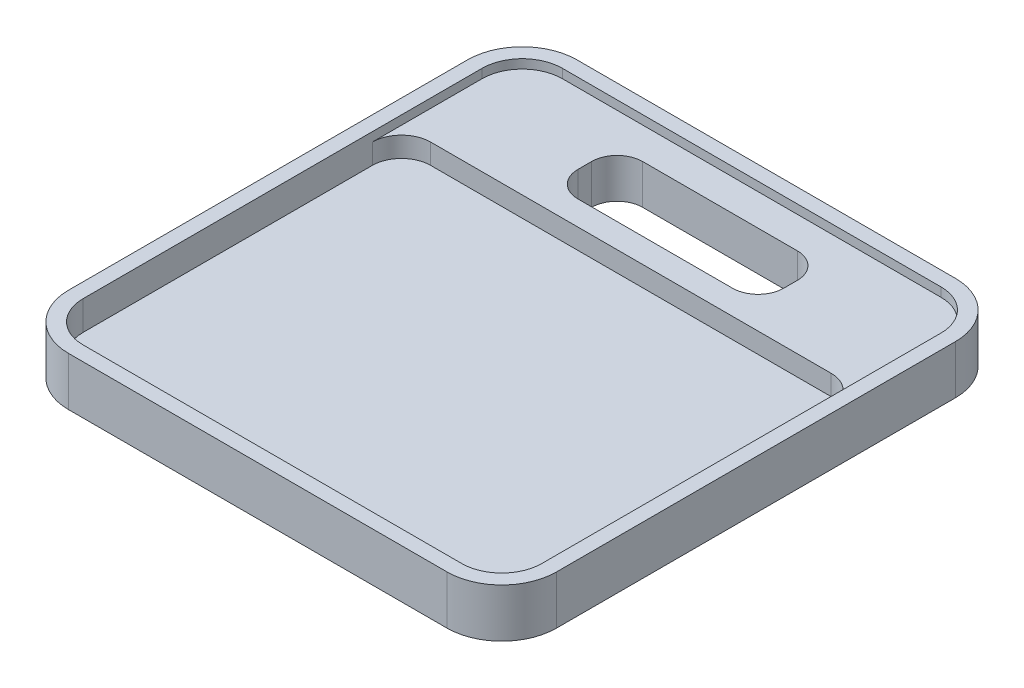
from build123d import *

# Parameters (mm, degrees)
EXTRUDE_1_DEPTH     = 2
CUT_EXTRUDE_1_DEPTH = 15.604642381
EXTRUDE_START       = -1.63
EXTRUDE_2_DEPTH     = 1.63
CUT_EXTRUDE_2_DEPTH = 1.2
CUT_EXTRUDE_3_DEPTH = 0.37
FILLET_3_R          = 1.2


with BuildPart() as part:
    # 草图1 → 凸台-拉伸1 (new body)
    with BuildSketch(Plane(origin=(0, 0, 0), x_dir=(-1, 0, 0), z_dir=(0, 1, 0))):
        with BuildLine():
            Line((7.77, 10.437594514), (-7.77, 10.437594514))
            ThreePointArc((-7.77, 10.437594514), (-9.359289322, 9.779289322), (-10.017594514, 8.19))
            Line((-10.017594514, 8.19), (-10.017594514, -8.19))
            ThreePointArc((-10.017594514, -8.19), (-9.359289322, -9.779289322), (-7.77, -10.437594514))
            Line((-7.77, -10.437594514), (7.77, -10.437594514))
            ThreePointArc((7.77, -10.437594514), (9.359289322, -9.779289322), (10.017594514, -8.19))
            Line((10.017594514, -8.19), (10.017594514, 8.19))
            ThreePointArc((10.017594514, 8.19), (9.359289322, 9.779289322), (7.77, 10.437594514))
        make_face()
    extrude(amount=EXTRUDE_1_DEPTH)

    # 草图3 → 切除-拉伸1 (cut, through all)
    with BuildSketch(Plane(origin=(0, 2, 0), x_dir=(1, 0, 0), z_dir=(0, 1, 0))):
        with BuildLine():
            Line((3.175, 8.940777212), (-3.175, 8.940777212))
            ThreePointArc((-3.175, 8.940777212), (-4.200304833, 8.516082045), (-4.625, 7.490777212))
            Line((-4.625, 7.490777212), (-4.625, 6.930777212))
            ThreePointArc((-4.625, 6.930777212), (-4.200304833, 5.90547238), (-3.175, 5.480777212))
            Line((-3.175, 5.480777212), (3.175, 5.480777212))
            ThreePointArc((3.175, 5.480777212), (4.200304833, 5.90547238), (4.625, 6.930777212))
            Line((4.625, 6.930777212), (4.625, 7.490777212))
            ThreePointArc((4.625, 7.490777212), (4.200304833, 8.516082045), (3.175, 8.940777212))
        make_face()
    extrude(amount=-CUT_EXTRUDE_1_DEPTH, mode=Mode.SUBTRACT)

    # 草图4 → 凸台-拉伸2 (add)
    with BuildSketch(Plane.XZ.offset(EXTRUDE_START)):
        with BuildLine():
            Line((-4.625, -7.490777212), (-4.625, -6.930777212))
            ThreePointArc((-4.625, -6.930777212), (-4.200304833, -5.90547238), (-3.175, -5.480777212))
            Line((-3.175, -5.480777212), (3.175, -5.480777212))
            ThreePointArc((3.175, -5.480777212), (4.200304833, -5.90547238), (4.625, -6.930777212))
            Line((4.625, -6.930777212), (4.625, -7.490777212))
            ThreePointArc((4.625, -7.490777212), (4.200304833, -8.516082045), (3.175, -8.940777212))
            Line((3.175, -8.940777212), (-3.175, -8.940777212))
            ThreePointArc((-3.175, -8.940777212), (-4.200304833, -8.516082045), (-4.625, -7.490777212))
        make_face()
        with BuildLine():
            Line((3.175, -8.540777212), (-3.175, -8.540777212))
            ThreePointArc((-3.175, -8.540777212), (-3.91746212, -8.233239333), (-4.225, -7.490777212))
            Line((-4.225, -7.490777212), (-4.225, -6.930777212))
            ThreePointArc((-4.225, -6.930777212), (-3.91746212, -6.188315092), (-3.175, -5.880777212))
            Line((-3.175, -5.880777212), (3.175, -5.880777212))
            ThreePointArc((3.175, -5.880777212), (3.91746212, -6.188315092), (4.225, -6.930777212))
            Line((4.225, -6.930777212), (4.225, -7.490777212))
            ThreePointArc((4.225, -7.490777212), (3.91746212, -8.233239333), (3.175, -8.540777212))
        make_face(mode=Mode.SUBTRACT)
    extrude(amount=EXTRUDE_2_DEPTH)

    # 草图5 → 切除-拉伸2 (cut)
    with BuildSketch(Plane(origin=(0, 2, 0), x_dir=(1, 0, 0), z_dir=(0, 1, 0))):
        with BuildLine():
            Line((9.417594514, 4.880777212), (-9.417594514, 4.880777212))
            Line((-9.417594514, 4.880777212), (-9.417594514, -8.19))
            ThreePointArc((-9.417594514, -8.19), (-8.935025253, -9.355025253), (-7.77, -9.837594514))
            Line((-7.77, -9.837594514), (7.77, -9.837594514))
            ThreePointArc((7.77, -9.837594514), (8.935025253, -9.355025253), (9.417594514, -8.19))
            Line((9.417594514, -8.19), (9.417594514, 4.880777212))
        make_face()
    extrude(amount=-CUT_EXTRUDE_2_DEPTH, mode=Mode.SUBTRACT)

    # 草图7 → 切除-拉伸3 (cut)
    with BuildSketch(Plane(origin=(0, 2, 0), x_dir=(1, 0, 0), z_dir=(0, 1, 0))):
        with BuildLine():
            Line((9.417594514, 8.19), (9.417594514, 4.880777212))
            Line((9.417594514, 4.880777212), (-9.417594514, 4.880777212))
            Line((-9.417594514, 4.880777212), (-9.417594514, 8.19))
            ThreePointArc((-9.417594514, 8.19), (-8.935025253, 9.355025253), (-7.77, 9.837594514))
            Line((-7.77, 9.837594514), (7.77, 9.837594514))
            ThreePointArc((7.77, 9.837594514), (8.935025253, 9.355025253), (9.417594514, 8.19))
        make_face()
    extrude(amount=-CUT_EXTRUDE_3_DEPTH, mode=Mode.SUBTRACT)

    # 圆角3
    fillet_3_edges = [part.edges().sort_by_distance(p)[0] for p in [
        (9.417594514, 1.215, -4.880777212),
        (-9.417594514, 1.215, -4.880777212),
    ]]
    fillet(fillet_3_edges, radius=FILLET_3_R)


solid = part.part
